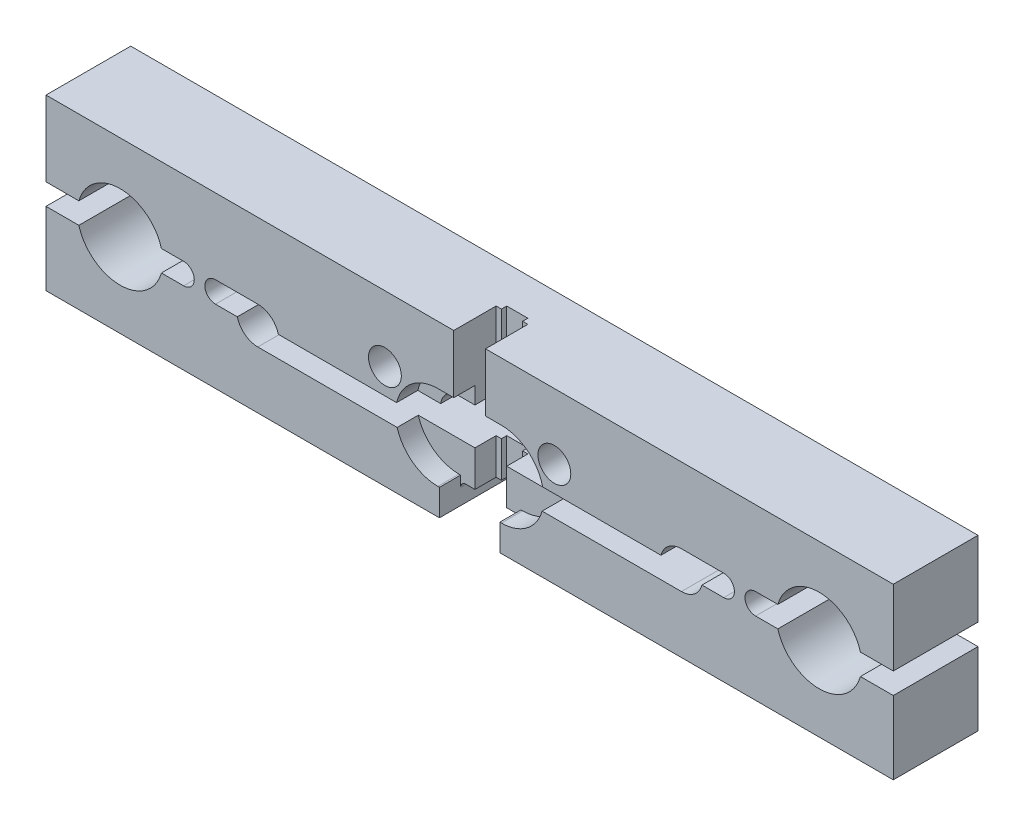
from build123d import *

# Parameters (mm, degrees)
SKETCH_2_W           = 80
SKETCH_2_H           = 16
EXTRUDE_1_DEPTH      = 8
SKETCH_5_R           = 1.55
CUT_EXTRUDE_3_DEPTH  = 82.975606128
CUT_EXTRUDE_4_DEPTH  = 82.975606128
SKETCH_8_W           = 3
SKETCH_8_H           = 16
CUT_EXTRUDE_5_DEPTH  = 4
SKETCH_9_R           = 0.5
CUT_EXTRUDE_6_DEPTH  = 82.975606128
CUT_EXTRUDE_7_DEPTH  = 2
CUT_EXTRUDE_8_DEPTH  = 82.975606128
SKETCH_12_W          = 5.7
SKETCH_12_H          = 2.5
CUT_EXTRUDE_9_DEPTH  = 2
SKETCH_13_W          = 2
SKETCH_13_H          = 14
CUT_EXTRUDE_10_DEPTH = 0.5


with BuildPart() as part:
    # 草图2 → 凸台-拉伸1 (new body)
    with BuildSketch(Plane.XY):
        with Locations((40, 8)):
            Rectangle(SKETCH_2_W, SKETCH_2_H)
        with BuildLine():
            ThreePointArc((11.048765244, 7.9), (7, 11.85), (2.951234756, 7.9))
            ThreePointArc((2.951234756, 7.9), (7, 3.95), (11.048765244, 7.9))
        make_face(mode=Mode.SUBTRACT)
        with BuildLine():
            ThreePointArc((77.048765244, 7.9), (73, 11.85), (68.951234756, 7.9))
            ThreePointArc((68.951234756, 7.9), (73, 3.95), (77.048765244, 7.9))
        make_face(mode=Mode.SUBTRACT)
    extrude(amount=EXTRUDE_1_DEPTH)

    # 草图5 → 切除-拉伸3 (cut, through all)
    with BuildSketch(Plane.XY.offset(8)):
        with Locations((48, 9.8)):
            Circle(SKETCH_5_R)
        with Locations((32, 9.8)):
            Circle(SKETCH_5_R)
    extrude(amount=-CUT_EXTRUDE_3_DEPTH, mode=Mode.SUBTRACT)

    # 草图6 → 切除-拉伸4 (cut, through all)
    with BuildSketch(Plane.XY.offset(8)):
        with BuildLine():
            Line((3.102244235, 8.9), (0, 8.9))
            Line((0, 8.9), (0, 6.9))
            Line((0, 6.9), (3.102244235, 6.9))
            ThreePointArc((3.102244235, 6.9), (2.995402762, 7.395267856), (2.951234756, 7.9))
            ThreePointArc((2.951234756, 7.9), (2.995402762, 8.404732144), (3.102244235, 8.9))
        make_face()
        with BuildLine():
            ThreePointArc((60, 5.4), (61.224744871, 5.81886117), (61.936491673, 6.9))
            Line((61.936491673, 6.9), (64, 6.9))
            ThreePointArc((64, 6.9), (65, 7.9), (64, 8.9))
            Line((64, 8.9), (60, 8.9))
            ThreePointArc((60, 8.9), (58.775255129, 8.48113883), (58.063508327, 7.4))
            Line((58.063508327, 7.4), (21.936491673, 7.4))
            ThreePointArc((21.936491673, 7.4), (21.224744871, 8.48113883), (20, 8.9))
            Line((20, 8.9), (16, 8.9))
            ThreePointArc((16, 8.9), (15, 7.9), (16, 6.9))
            Line((16, 6.9), (18.063508327, 6.9))
            ThreePointArc((18.063508327, 6.9), (18.775255129, 5.81886117), (20, 5.4))
            Line((20, 5.4), (60, 5.4))
        make_face()
        with BuildLine():
            Line((76.897755765, 6.9), (80, 6.9))
            Line((80, 6.9), (80, 8.9))
            Line((80, 8.9), (76.897755765, 8.9))
            ThreePointArc((76.897755765, 8.9), (77.004597237, 8.404732144), (77.048765244, 7.9))
            ThreePointArc((77.048765244, 7.9), (77.004597237, 7.395267856), (76.897755765, 6.9))
        make_face()
        with BuildLine():
            Line((67, 6.9), (69.102244235, 6.9))
            ThreePointArc((69.102244235, 6.9), (68.995402763, 7.395267856), (68.951234756, 7.9))
            ThreePointArc((68.951234756, 7.9), (68.995402763, 8.404732144), (69.102244235, 8.9))
            Line((69.102244235, 8.9), (67, 8.9))
            ThreePointArc((67, 8.9), (66, 7.9), (67, 6.9))
        make_face()
        with BuildLine():
            Line((13, 8.9), (10.897755764, 8.9))
            ThreePointArc((10.897755764, 8.9), (11.004597237, 8.404732144), (11.048765244, 7.9))
            ThreePointArc((11.048765244, 7.9), (11.004597237, 7.395267856), (10.897755764, 6.9))
            Line((10.897755764, 6.9), (13, 6.9))
            ThreePointArc((13, 6.9), (14, 7.9), (13, 8.9))
        make_face()
    extrude(amount=-CUT_EXTRUDE_4_DEPTH, mode=Mode.SUBTRACT)

    # 草图8 → 切除-拉伸5 (cut)
    with BuildSketch(Plane.XY.offset(8)):
        with Locations((40, 8)):
            Rectangle(SKETCH_8_W, SKETCH_8_H)
    extrude(amount=-CUT_EXTRUDE_5_DEPTH, mode=Mode.SUBTRACT)

    # 草图9 → 切除-拉伸6 (cut, through all)
    with BuildSketch(Plane.XY.offset(8)):
        with Locations((37.65, 1.5)):
            Circle(SKETCH_9_R)
        with Locations((42.35, 1.5)):
            Circle(SKETCH_9_R)
        with BuildLine():
            Line((38.5, 2), (38.5, 0))
            Line((38.5, 0), (42.85, 0))
            Line((42.85, 0), (42.85, 1.5))
            ThreePointArc((42.85, 1.5), (41.996446609, 1.146446609), (42.35, 2))
            Line((42.35, 2), (38.5, 2))
        make_face()
        with BuildLine():
            Line((37.15, 1.5), (37.15, 0))
            Line((37.15, 0), (38.5, 0))
            Line((38.5, 0), (38.5, 2))
            Line((38.5, 2), (37.65, 2))
            ThreePointArc((37.65, 2), (38.003553391, 1.853553391), (38.15, 1.5))
            ThreePointArc((38.15, 1.5), (37.65, 1), (37.15, 1.5))
        make_face()
    extrude(amount=-CUT_EXTRUDE_6_DEPTH, mode=Mode.SUBTRACT)

    # 草图10 → 切除-拉伸7 (cut)
    with BuildSketch(Plane.XY.offset(8)):
        with BuildLine():
            Line((37, 10.5), (43, 10.5))
            ThreePointArc((43, 10.5), (47, 6.5), (43, 2.5))
            Line((43, 2.5), (37, 2.5))
            ThreePointArc((37, 2.5), (33, 6.5), (37, 10.5))
        make_face()
    extrude(amount=-CUT_EXTRUDE_7_DEPTH, mode=Mode.SUBTRACT)

    # 草图11 → 切除-拉伸8 (cut, through all)
    with BuildSketch(Plane.XY.offset(8)):
        with BuildLine():
            Line((37, 5.4), (43, 5.4))
            ThreePointArc((43, 5.4), (44.75, 7.15), (43, 8.9))
            Line((43, 8.9), (37, 8.9))
            ThreePointArc((37, 8.9), (35.25, 7.15), (37, 5.4))
        make_face()
    extrude(amount=-CUT_EXTRUDE_8_DEPTH, mode=Mode.SUBTRACT)

    # 草图12 → 切除-拉伸9 (cut)
    with BuildSketch(Plane.XY.offset(8)):
        with Locations((40, 1.25)):
            Rectangle(SKETCH_12_W, SKETCH_12_H)
    extrude(amount=-CUT_EXTRUDE_9_DEPTH, mode=Mode.SUBTRACT)

    # 草图13 → 切除-拉伸10 (cut)
    with BuildSketch(Plane.XY.offset(4)):
        with Locations((40, 9)):
            Rectangle(SKETCH_13_W, SKETCH_13_H)
    extrude(amount=-CUT_EXTRUDE_10_DEPTH, mode=Mode.SUBTRACT)


solid = part.part
